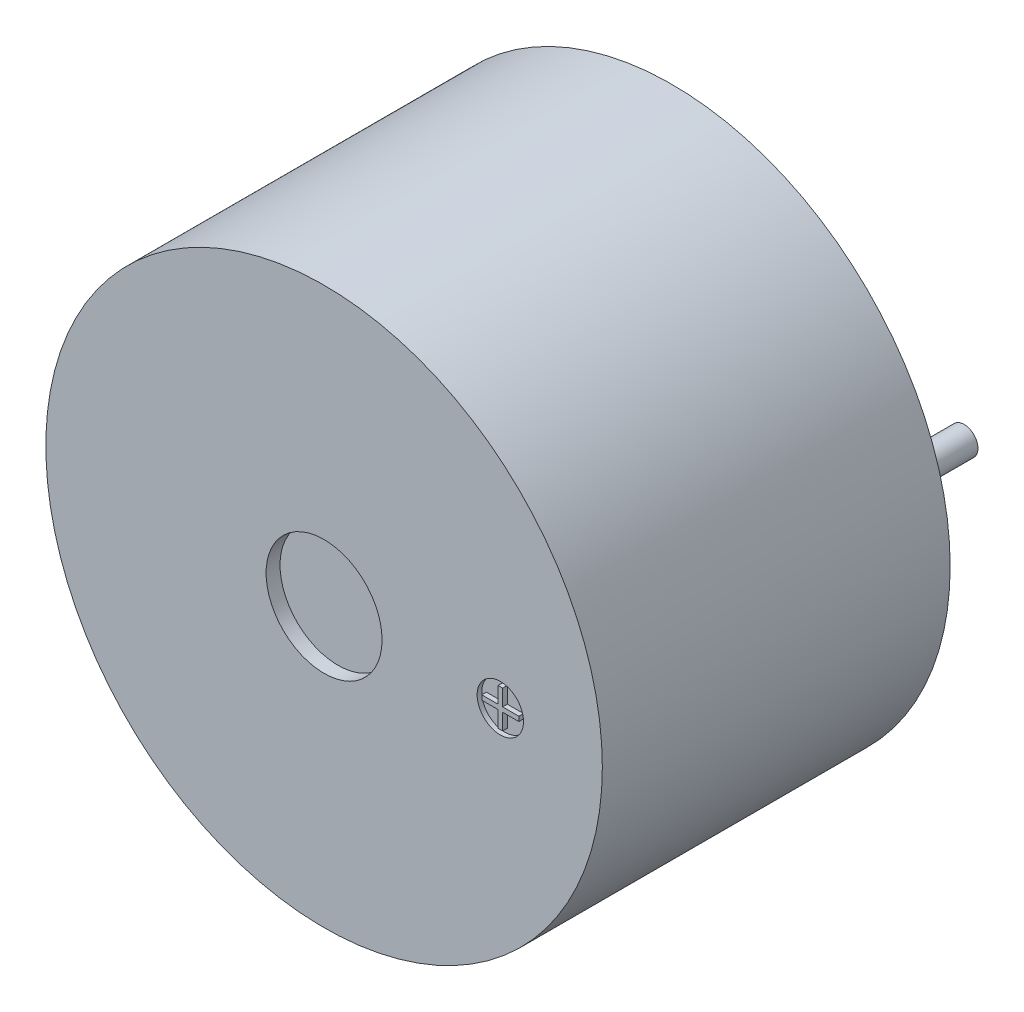
from build123d import *

# Parameters (mm, degrees)
SKETCH1_R           = 6
BOSS_EXTRUDE1_DEPTH = 7.5
SKETCH2_R           = 0.3
BOSS_EXTRUDE2_DEPTH = 2.5
SKETCH3_R           = 1.25
CUT_EXTRUDE1_DEPTH  = 1.8
SKETCH4_R           = 5.7
CUT_EXTRUDE2_DEPTH  = 1.5
SKETCH5_R           = 0.5
CUT_EXTRUDE3_DEPTH  = 0.1
SKETCH6_W           = 0.35
SKETCH6_H           = 0.1
SKETCH6_W_2         = 0.1
SKETCH6_H_2         = 0.35
BOSS_EXTRUDE3_DEPTH = 0.1


with BuildPart() as part:
    # Sketch1 → Boss-Extrude1 (new body)
    with BuildSketch(Plane.XY):
        Circle(SKETCH1_R)
    extrude(amount=BOSS_EXTRUDE1_DEPTH)

    # Sketch2 → Boss-Extrude2 (add)
    with BuildSketch(Plane(origin=(0, 0, 0), x_dir=(-1, 0, 0), z_dir=(0, 0, -1))):
        with Locations(Location((3.8, 0, 0), (0, 0, 180))):
            Circle(SKETCH2_R)
        with Locations(Location((-3.8, 0, 0), (0, 0, 180))):
            Circle(SKETCH2_R)
    extrude(amount=BOSS_EXTRUDE2_DEPTH)

    # Sketch3 → Cut-Extrude1 (cut)
    with BuildSketch(Plane.XY.offset(7.5)):
        Circle(SKETCH3_R)
    extrude(amount=-CUT_EXTRUDE1_DEPTH, mode=Mode.SUBTRACT)

    # Sketch4 → Cut-Extrude2 (cut)
    with BuildSketch(Plane.XY.offset(5.7)):
        Circle(SKETCH4_R)
    extrude(amount=CUT_EXTRUDE2_DEPTH, mode=Mode.SUBTRACT)

    # Sketch5 → Cut-Extrude3 (cut)
    with BuildSketch(Plane.XY.offset(7.5)):
        with Locations((3.8, 0)):
            Circle(SKETCH5_R)
    extrude(amount=-CUT_EXTRUDE3_DEPTH, mode=Mode.SUBTRACT)

    # Sketch6 → Boss-Extrude3 (add)
    with BuildSketch(Plane.XY.offset(7.4)):
        with Locations((4.025, 0)):
            Rectangle(SKETCH6_W, SKETCH6_H)
        with Locations((3.575, 0)):
            Rectangle(SKETCH6_W, SKETCH6_H)
        with Locations((3.8, 0.225)):
            Rectangle(SKETCH6_W_2, SKETCH6_H_2)
        with Locations((3.8, -0.225)):
            Rectangle(SKETCH6_W_2, SKETCH6_H_2)
        with Locations((3.8, 0)):
            Rectangle(SKETCH6_W_2, SKETCH6_H)
    extrude(amount=BOSS_EXTRUDE3_DEPTH)


solid = part.part
